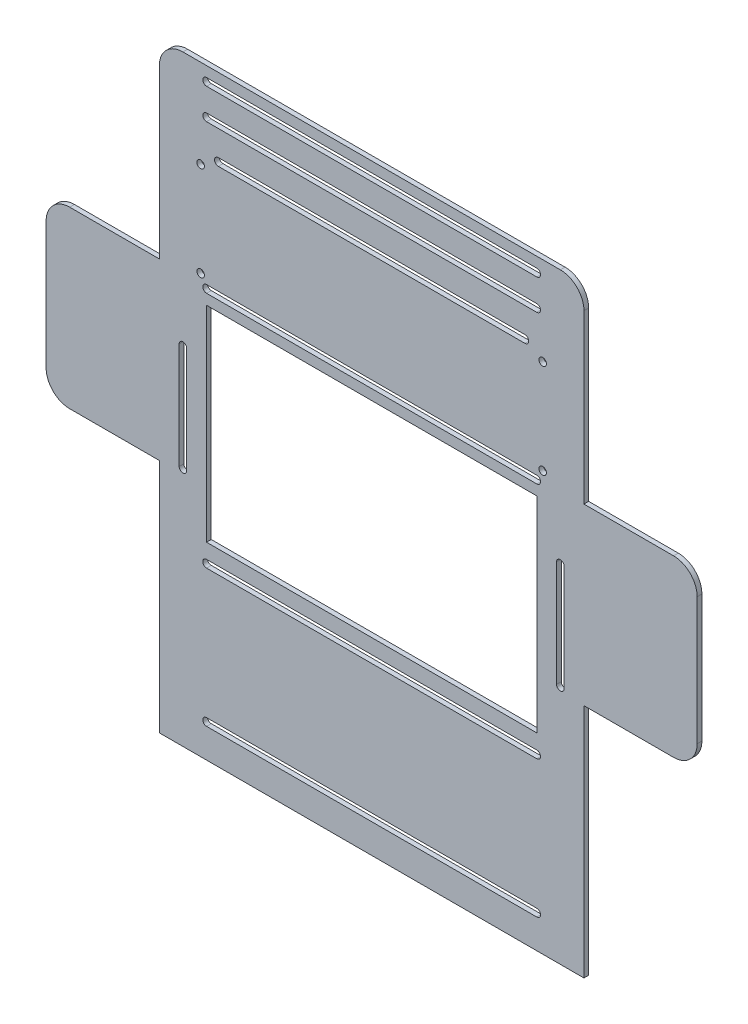
from build123d import *

# Parameters (mm, degrees)
EXTRUDE_1_DEPTH     = 2
SKETCH_3_W          = 180
SKETCH_3_H          = 35
EXTRUDE_2_DEPTH     = 2
SKETCH_4_W          = 180
SKETCH_4_H          = 20
EXTRUDE_3_DEPTH     = 2
SKETCH_5_W          = 140
SKETCH_5_H          = 87
CUT_EXTRUDE_1_DEPTH = 194.062166154
FILLET_1_R          = 10
FILLET_2_R          = 10
FILLET_3_R          = 10
FILLET_4_R          = 10
CUT_EXTRUDE_2_DEPTH = 10
FILLET_5_R          = 10
FILLET_6_R          = 10
CUT_EXTRUDE_5_DEPTH = 10
CUT_EXTRUDE_6_DEPTH = 194.062166154
CUT_EXTRUDE_7_DEPTH = 194.062166154
SKETCH_13_R         = 1.6
CUT_EXTRUDE_8_DEPTH = 10


with BuildPart() as part:
    # 草图2 → 凸台-拉伸1 (new body)
    with BuildSketch(Plane.XY):
        Polygon((90, 100), (90, 39), (138, 39), (138, -35), (90, -35), (90, -100), (-90, -100), (-90, -35), (-138, -35), (-138, 39), (-90, 39), (-90, 100), align=None)
    extrude(amount=EXTRUDE_1_DEPTH)

    # 草图3 → 凸台-拉伸2 (add)
    with BuildSketch(Plane.XY.offset(2)):
        with Locations((0, -117.5)):
            Rectangle(SKETCH_3_W, SKETCH_3_H)
    extrude(amount=-EXTRUDE_2_DEPTH)

    # 草图4 → 凸台-拉伸3 (add)
    with BuildSketch(Plane.XY.offset(2)):
        with Locations((0, 110)):
            Rectangle(SKETCH_4_W, SKETCH_4_H)
    extrude(amount=-EXTRUDE_3_DEPTH)

    # 草图5 → 切除-拉伸1 (cut, through all)
    with BuildSketch(Plane(origin=(0, 0, 0), x_dir=(-1, 0, 0), z_dir=(0, 0, -1))):
        with Locations((0, -11.5)):
            Rectangle(SKETCH_5_W, SKETCH_5_H)
    extrude(amount=-CUT_EXTRUDE_1_DEPTH, mode=Mode.SUBTRACT)

    # 圆角1
    fillet_1_edges = [part.edges().sort_by_distance(p)[0] for p in [
        (138, -35, 1),
    ]]
    fillet(fillet_1_edges, radius=FILLET_1_R)

    # 圆角2
    fillet_2_edges = [part.edges().sort_by_distance(p)[0] for p in [
        (138, 39, 1),
    ]]
    fillet(fillet_2_edges, radius=FILLET_2_R)

    # 圆角3
    fillet_3_edges = [part.edges().sort_by_distance(p)[0] for p in [
        (-138, 39, 1),
    ]]
    fillet(fillet_3_edges, radius=FILLET_3_R)

    # 圆角4
    fillet_4_edges = [part.edges().sort_by_distance(p)[0] for p in [
        (-138, -35, 1),
    ]]
    fillet(fillet_4_edges, radius=FILLET_4_R)

    # 草图7 → 切除-拉伸2 (cut)
    with BuildSketch(Plane(origin=(0, 0, 0), x_dir=(-1, 0, 0), z_dir=(0, 0, -1))):
        with BuildLine():
            Line((-70, 115.6), (70, 115.6))
            ThreePointArc((70, 115.6), (71.6, 114), (70, 112.4))
            Line((70, 112.4), (-70, 112.4))
            ThreePointArc((-70, 112.4), (-71.6, 114), (-70, 115.6))
        make_face()
        with BuildLine():
            Line((-70, 102.6), (70, 102.6))
            ThreePointArc((70, 102.6), (71.6, 101), (70, 99.4))
            Line((70, 99.4), (-70, 99.4))
            ThreePointArc((-70, 99.4), (-71.6, 101), (-70, 102.6))
        make_face()
        with BuildLine():
            Line((-70, 39.6), (70, 39.6))
            ThreePointArc((70, 39.6), (71.6, 38), (70, 36.4))
            Line((70, 36.4), (-70, 36.4))
            ThreePointArc((-70, 36.4), (-71.6, 38), (-70, 39.6))
        make_face()
    extrude(amount=-CUT_EXTRUDE_2_DEPTH, mode=Mode.SUBTRACT)

    # 圆角5
    fillet_5_edges = [part.edges().sort_by_distance(p)[0] for p in [
        (-90, 120, 1),
    ]]
    fillet(fillet_5_edges, radius=FILLET_5_R)

    # 圆角6
    fillet_6_edges = [part.edges().sort_by_distance(p)[0] for p in [
        (90, 120, 1),
    ]]
    fillet(fillet_6_edges, radius=FILLET_6_R)

    # 草图10 → 切除-拉伸5 (cut)
    with BuildSketch(Plane(origin=(0, 0, 0), x_dir=(-1, 0, 0), z_dir=(0, 0, -1))):
        with BuildLine():
            Line((-70, -61.3), (70, -61.3))
            ThreePointArc((70, -61.3), (71.6, -62.9), (70, -64.5))
            Line((70, -64.5), (-70, -64.5))
            ThreePointArc((-70, -64.5), (-71.6, -62.9), (-70, -61.3))
        make_face()
        with BuildLine():
            Line((-70, -119.4), (70, -119.4))
            ThreePointArc((70, -119.4), (71.6, -121), (70, -122.6))
            Line((70, -122.6), (-70, -122.6))
            ThreePointArc((-70, -122.6), (-71.6, -121), (-70, -119.4))
        make_face()
    extrude(amount=-CUT_EXTRUDE_5_DEPTH, mode=Mode.SUBTRACT)

    # 草图11 → 切除-拉伸6 (cut, through all)
    with BuildSketch(Plane.XY.offset(2)):
        with BuildLine():
            Line((-65, 88.7), (65, 88.7))
            ThreePointArc((65, 88.7), (66.6, 87.1), (65, 85.5))
            Line((65, 85.5), (-65, 85.5))
            ThreePointArc((-65, 85.5), (-66.6, 87.1), (-65, 88.7))
        make_face()
    extrude(amount=-CUT_EXTRUDE_6_DEPTH, mode=Mode.SUBTRACT)

    # 草图12 → 切除-拉伸7 (cut, through all)
    with BuildSketch(Plane.XY.offset(2)):
        with BuildLine():
            Line((81.6, 12), (81.6, -33))
            ThreePointArc((81.6, -33), (80, -34.6), (78.4, -33))
            Line((78.4, -33), (78.4, 12))
            ThreePointArc((78.4, 12), (80, 13.6), (81.6, 12))
        make_face()
        with BuildLine():
            Line((-81.6, 12), (-81.6, -33))
            ThreePointArc((-81.6, -33), (-80, -34.6), (-78.4, -33))
            Line((-78.4, -33), (-78.4, 12))
            ThreePointArc((-78.4, 12), (-80, 13.6), (-81.6, 12))
        make_face()
    extrude(amount=-CUT_EXTRUDE_7_DEPTH, mode=Mode.SUBTRACT)

    # 草图13 → 切除-拉伸8 (cut)
    with BuildSketch(Plane.XY.offset(2)):
        with Locations((-72.5, 82.5)):
            Circle(SKETCH_13_R)
        with Locations((-72.5, 42.5)):
            Circle(SKETCH_13_R)
        with Locations((72.5, 82.5)):
            Circle(SKETCH_13_R)
        with Locations((72.5, 42.5)):
            Circle(SKETCH_13_R)
    extrude(amount=-CUT_EXTRUDE_8_DEPTH, mode=Mode.SUBTRACT)


solid = part.part
